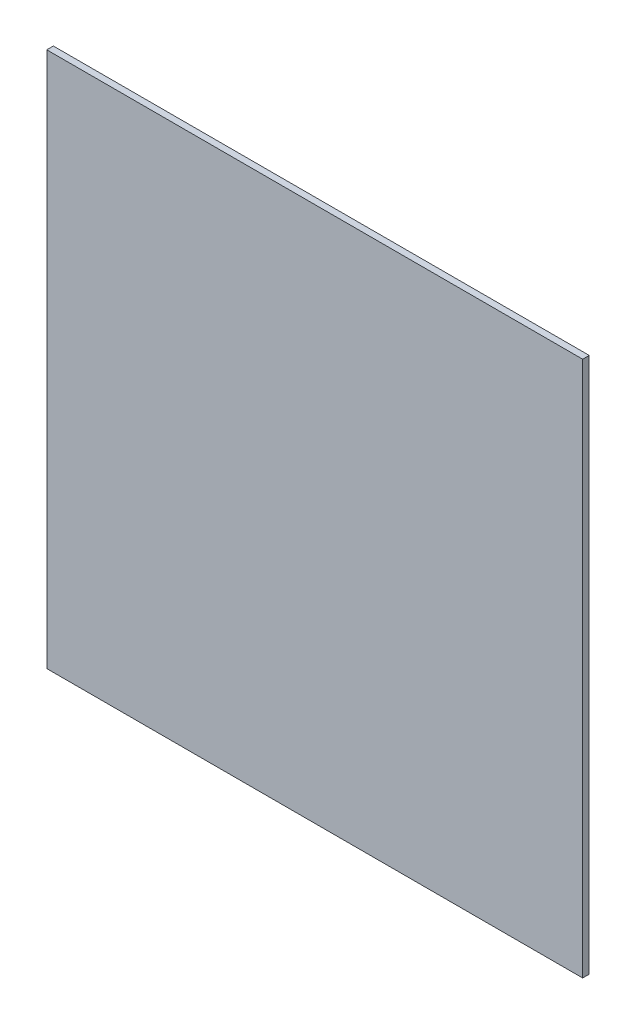
from build123d import *

# Parameters (mm, degrees)
SKETCH1_W           = 711.2
SKETCH1_H           = 711.2
BOSS_EXTRUDE1_DEPTH = 8.73125


with BuildPart() as part:
    # Sketch1 → Boss-Extrude1 (new body)
    with BuildSketch(Plane.XY):
        with Locations((355.6, 355.6)):
            Rectangle(SKETCH1_W, SKETCH1_H)
    extrude(amount=BOSS_EXTRUDE1_DEPTH)


solid = part.part
